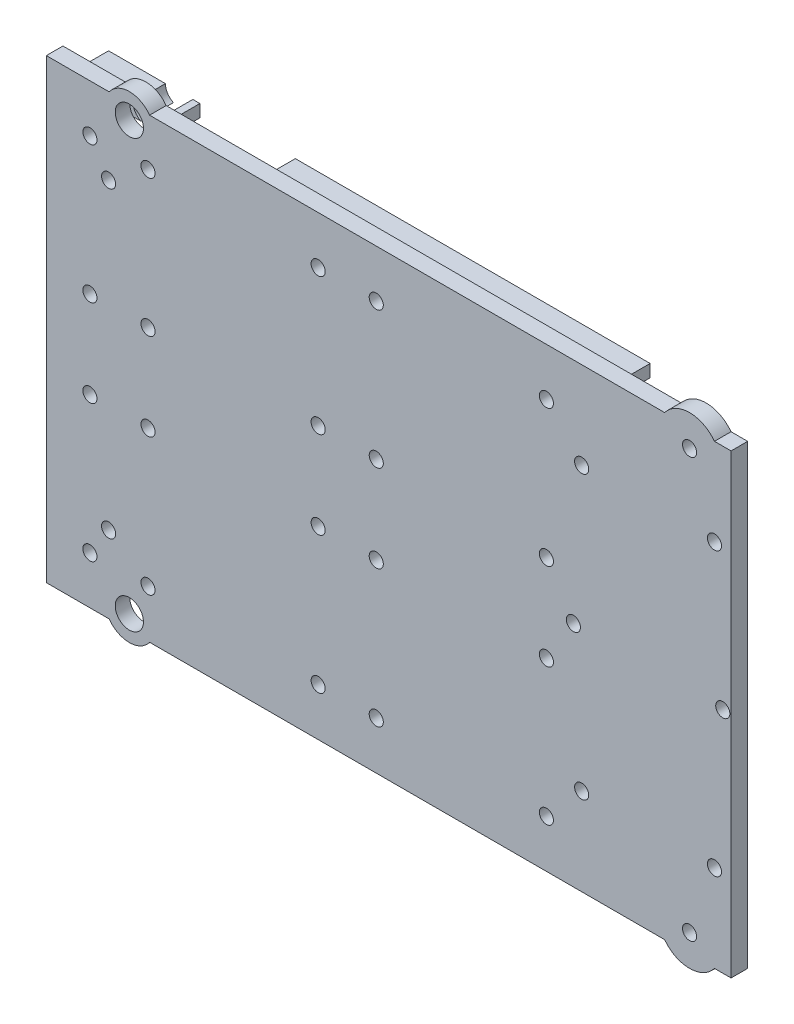
from build123d import *
from build123d.topology import SkipClean

# Parameters (mm, degrees)
MAIN_PROFILE_SKETCH_R       = 3.4
MAIN_PROFILE_SKETCH_R_2     = 1.7
MAIN_EXTRUSION_DEPTH        = 3.5
DETAIL_PROFILE_2_SKETCH_R   = 5.3
DETAIL_PROFILE_2_SKETCH_R_2 = 1.7
DETAIL_EXTRUSION_2_DEPTH    = 0.5
DETAIL_PROFILE_3_SKETCH_W   = 85.5
DETAIL_PROFILE_3_SKETCH_H   = 3
DETAIL_EXTRUSION_3_DEPTH    = 0.2
DETAIL_PROFILE_4_SKETCH_W   = 85.5
DETAIL_PROFILE_4_SKETCH_H   = 3
DETAIL_EXTRUSION_4_DEPTH    = 7.8


with BuildPart() as part:
    # Main Profile Sketch → Main Extrusion (new body)
    with BuildSketch(Plane.XY.offset(48.5)):
        with BuildLine():
            Line((55, -55), (70.126602828, -55))
            ThreePointArc((70.126602828, -55), (75, -57.5), (79.873397172, -55))
            Line((79.873397172, -55), (204, -55))
            ThreePointArc((204, -55), (210, -58), (216, -55))
            Line((216, -55), (220, -55))
            Line((220, -55), (220, 55))
            Line((220, 55), (216, 55))
            ThreePointArc((216, 55), (210, 58), (204, 55))
            Line((204, 55), (79.873397172, 55))
            ThreePointArc((79.873397172, 55), (75, 57.5), (70.126602828, 55))
            Line((70.126602828, 55), (55, 55))
            Line((55, 55), (55, -55))
        make_face()
        with Locations((75, -51.5)):
            Circle(MAIN_PROFILE_SKETCH_R, mode=Mode.SUBTRACT)
        with Locations((65.5, -43.5)):
            Circle(MAIN_PROFILE_SKETCH_R_2, mode=Mode.SUBTRACT)
        with Locations((70, -36.5)):
            Circle(MAIN_PROFILE_SKETCH_R_2, mode=Mode.SUBTRACT)
        with Locations((79.5, -43.5)):
            Circle(MAIN_PROFILE_SKETCH_R_2, mode=Mode.SUBTRACT)
        with Locations((120.5, -43.5)):
            Circle(MAIN_PROFILE_SKETCH_R_2, mode=Mode.SUBTRACT)
        with Locations((134.5, -43.5)):
            Circle(MAIN_PROFILE_SKETCH_R_2, mode=Mode.SUBTRACT)
        with Locations((65.5, -10.5)):
            Circle(MAIN_PROFILE_SKETCH_R_2, mode=Mode.SUBTRACT)
        with Locations((79.5, -10.5)):
            Circle(MAIN_PROFILE_SKETCH_R_2, mode=Mode.SUBTRACT)
        with Locations((120.5, -10.5)):
            Circle(MAIN_PROFILE_SKETCH_R_2, mode=Mode.SUBTRACT)
        with Locations((134.5, -10.5)):
            Circle(MAIN_PROFILE_SKETCH_R_2, mode=Mode.SUBTRACT)
        with Locations((175.5, -43.5)):
            Circle(MAIN_PROFILE_SKETCH_R_2, mode=Mode.SUBTRACT)
        with Locations((210, -50.5)):
            Circle(MAIN_PROFILE_SKETCH_R_2, mode=Mode.SUBTRACT)
        with Locations((184, -34)):
            Circle(MAIN_PROFILE_SKETCH_R_2, mode=Mode.SUBTRACT)
        with Locations((216, -34)):
            Circle(MAIN_PROFILE_SKETCH_R_2, mode=Mode.SUBTRACT)
        with Locations((175.5, -10.5)):
            Circle(MAIN_PROFILE_SKETCH_R_2, mode=Mode.SUBTRACT)
        with Locations((65.5, 10.5)):
            Circle(MAIN_PROFILE_SKETCH_R_2, mode=Mode.SUBTRACT)
        with Locations((79.5, 10.5)):
            Circle(MAIN_PROFILE_SKETCH_R_2, mode=Mode.SUBTRACT)
        with Locations((120.5, 10.5)):
            Circle(MAIN_PROFILE_SKETCH_R_2, mode=Mode.SUBTRACT)
        with Locations((134.5, 10.5)):
            Circle(MAIN_PROFILE_SKETCH_R_2, mode=Mode.SUBTRACT)
        with Locations((70, 36.5)):
            Circle(MAIN_PROFILE_SKETCH_R_2, mode=Mode.SUBTRACT)
        with Locations((65.5, 43.5)):
            Circle(MAIN_PROFILE_SKETCH_R_2, mode=Mode.SUBTRACT)
        with Locations((75, 51.5)):
            Circle(MAIN_PROFILE_SKETCH_R, mode=Mode.SUBTRACT)
        with Locations((79.5, 43.5)):
            Circle(MAIN_PROFILE_SKETCH_R_2, mode=Mode.SUBTRACT)
        with Locations((120.5, 43.5)):
            Circle(MAIN_PROFILE_SKETCH_R_2, mode=Mode.SUBTRACT)
        with Locations((134.5, 43.5)):
            Circle(MAIN_PROFILE_SKETCH_R_2, mode=Mode.SUBTRACT)
        with Locations((175.5, 10.5)):
            Circle(MAIN_PROFILE_SKETCH_R_2, mode=Mode.SUBTRACT)
        with Locations((182, 0)):
            Circle(MAIN_PROFILE_SKETCH_R_2, mode=Mode.SUBTRACT)
        with Locations((218, 0)):
            Circle(MAIN_PROFILE_SKETCH_R_2, mode=Mode.SUBTRACT)
        with Locations((175.5, 43.5)):
            Circle(MAIN_PROFILE_SKETCH_R_2, mode=Mode.SUBTRACT)
        with Locations((184, 34)):
            Circle(MAIN_PROFILE_SKETCH_R_2, mode=Mode.SUBTRACT)
        with Locations((216, 34)):
            Circle(MAIN_PROFILE_SKETCH_R_2, mode=Mode.SUBTRACT)
        with Locations((210, 50.5)):
            Circle(MAIN_PROFILE_SKETCH_R_2, mode=Mode.SUBTRACT)
    extrude(amount=-MAIN_EXTRUSION_DEPTH)

    # Detail Profile 2 Sketch → Detail Extrusion 2 (add)
    with BuildSketch(Plane.XY.offset(45)):
        with BuildLine():
            Line((55, -55), (70.126602828, -55))
            ThreePointArc((70.126602828, -55), (75, -57.5), (79.873397172, -55))
            Line((79.873397172, -55), (204, -55))
            ThreePointArc((204, -55), (210, -58), (216, -55))
            Line((216, -55), (220, -55))
            Line((220, -55), (220, 55))
            Line((220, 55), (216, 55))
            ThreePointArc((216, 55), (210, 58), (204, 55))
            Line((204, 55), (79.873397172, 55))
            ThreePointArc((79.873397172, 55), (75, 57.5), (70.126602828, 55))
            Line((70.126602828, 55), (55, 55))
            Line((55, 55), (55, -55))
        make_face()
        with Locations((75, -51.5)):
            Circle(DETAIL_PROFILE_2_SKETCH_R, mode=Mode.SUBTRACT)
        with Locations((65.5, -43.5)):
            Circle(DETAIL_PROFILE_2_SKETCH_R_2, mode=Mode.SUBTRACT)
        with Locations((70, -36.5)):
            Circle(DETAIL_PROFILE_2_SKETCH_R_2, mode=Mode.SUBTRACT)
        with Locations((79.5, -43.5)):
            Circle(DETAIL_PROFILE_2_SKETCH_R_2, mode=Mode.SUBTRACT)
        with Locations((120.5, -43.5)):
            Circle(DETAIL_PROFILE_2_SKETCH_R_2, mode=Mode.SUBTRACT)
        with Locations((134.5, -43.5)):
            Circle(DETAIL_PROFILE_2_SKETCH_R_2, mode=Mode.SUBTRACT)
        with Locations((65.5, -10.5)):
            Circle(DETAIL_PROFILE_2_SKETCH_R_2, mode=Mode.SUBTRACT)
        with Locations((79.5, -10.5)):
            Circle(DETAIL_PROFILE_2_SKETCH_R_2, mode=Mode.SUBTRACT)
        with Locations((120.5, -10.5)):
            Circle(DETAIL_PROFILE_2_SKETCH_R_2, mode=Mode.SUBTRACT)
        with Locations((134.5, -10.5)):
            Circle(DETAIL_PROFILE_2_SKETCH_R_2, mode=Mode.SUBTRACT)
        with Locations((175.5, -43.5)):
            Circle(DETAIL_PROFILE_2_SKETCH_R_2, mode=Mode.SUBTRACT)
        with Locations((210, -50.5)):
            Circle(DETAIL_PROFILE_2_SKETCH_R_2, mode=Mode.SUBTRACT)
        with Locations((184, -34)):
            Circle(DETAIL_PROFILE_2_SKETCH_R_2, mode=Mode.SUBTRACT)
        with Locations((216, -34)):
            Circle(DETAIL_PROFILE_2_SKETCH_R_2, mode=Mode.SUBTRACT)
        with Locations((175.5, -10.5)):
            Circle(DETAIL_PROFILE_2_SKETCH_R_2, mode=Mode.SUBTRACT)
        with Locations((65.5, 10.5)):
            Circle(DETAIL_PROFILE_2_SKETCH_R_2, mode=Mode.SUBTRACT)
        with Locations((79.5, 10.5)):
            Circle(DETAIL_PROFILE_2_SKETCH_R_2, mode=Mode.SUBTRACT)
        with Locations((120.5, 10.5)):
            Circle(DETAIL_PROFILE_2_SKETCH_R_2, mode=Mode.SUBTRACT)
        with Locations((134.5, 10.5)):
            Circle(DETAIL_PROFILE_2_SKETCH_R_2, mode=Mode.SUBTRACT)
        with Locations((70, 36.5)):
            Circle(DETAIL_PROFILE_2_SKETCH_R_2, mode=Mode.SUBTRACT)
        with Locations((65.5, 43.5)):
            Circle(DETAIL_PROFILE_2_SKETCH_R_2, mode=Mode.SUBTRACT)
        with Locations((75, 51.5)):
            Circle(DETAIL_PROFILE_2_SKETCH_R, mode=Mode.SUBTRACT)
        with Locations((79.5, 43.5)):
            Circle(DETAIL_PROFILE_2_SKETCH_R_2, mode=Mode.SUBTRACT)
        with Locations((120.5, 43.5)):
            Circle(DETAIL_PROFILE_2_SKETCH_R_2, mode=Mode.SUBTRACT)
        with Locations((134.5, 43.5)):
            Circle(DETAIL_PROFILE_2_SKETCH_R_2, mode=Mode.SUBTRACT)
        with Locations((175.5, 10.5)):
            Circle(DETAIL_PROFILE_2_SKETCH_R_2, mode=Mode.SUBTRACT)
        with Locations((182, 0)):
            Circle(DETAIL_PROFILE_2_SKETCH_R_2, mode=Mode.SUBTRACT)
        with Locations((218, 0)):
            Circle(DETAIL_PROFILE_2_SKETCH_R_2, mode=Mode.SUBTRACT)
        with Locations((175.5, 43.5)):
            Circle(DETAIL_PROFILE_2_SKETCH_R_2, mode=Mode.SUBTRACT)
        with Locations((184, 34)):
            Circle(DETAIL_PROFILE_2_SKETCH_R_2, mode=Mode.SUBTRACT)
        with Locations((216, 34)):
            Circle(DETAIL_PROFILE_2_SKETCH_R_2, mode=Mode.SUBTRACT)
        with Locations((210, 50.5)):
            Circle(DETAIL_PROFILE_2_SKETCH_R_2, mode=Mode.SUBTRACT)
    extrude(amount=-DETAIL_EXTRUSION_2_DEPTH)

    # Detail Profile 3 Sketch → Detail Extrusion 3 (add)
    with SkipClean():  # the faces are left unmerged after this step: merging them gives an invalid solid
        with BuildSketch(Plane.XY.offset(44.5)):
            with BuildLine():
                Line((58, -48.5), (70.630789545, -48.5))
                ThreePointArc((70.630789545, -48.5), (69.938043095, -49.929461145), (69.7, -51.5))
                Line((69.7, -51.5), (58, -51.5))
                Line((58, -51.5), (58, -48.5))
            make_face()
            with BuildLine():
                Line((79.369210455, -48.5), (80, -48.5))
                Line((80, -48.5), (80, -49.742160417))
                ThreePointArc((80, -49.742160417), (79.725596974, -49.100263923), (79.369210455, -48.5))
            make_face()
            with Locations((145.75, -50)):
                Rectangle(DETAIL_PROFILE_3_SKETCH_W, DETAIL_PROFILE_3_SKETCH_H)
            with BuildLine():
                Line((58, 51.5), (58, 48.5))
                Line((58, 48.5), (70.630789545, 48.5))
                ThreePointArc((70.630789545, 48.5), (69.938043095, 49.929461145), (69.7, 51.5))
                Line((69.7, 51.5), (58, 51.5))
            make_face()
            with BuildLine():
                Line((80, 49.742160417), (80, 48.5))
                Line((80, 48.5), (79.369210455, 48.5))
                ThreePointArc((79.369210455, 48.5), (79.725596974, 49.100263923), (80, 49.742160417))
            make_face()
            with Locations((145.75, 50)):
                Rectangle(DETAIL_PROFILE_3_SKETCH_W, DETAIL_PROFILE_3_SKETCH_H)
        extrude(amount=-DETAIL_EXTRUSION_3_DEPTH)

    # Detail Profile 4 Sketch → Detail Extrusion 4 (add)
    with SkipClean():  # the faces are left unmerged after this step: merging them gives an invalid solid
        with BuildSketch(Plane.XY.offset(44.3)):
            with BuildLine():
                Line((58, -48.5), (73.625227292, -48.5))
                ThreePointArc((73.625227292, -48.5), (72.222703658, -49.717691096), (71.7, -51.5))
                Line((71.7, -51.5), (58, -51.5))
                Line((58, -51.5), (58, -48.5))
            make_face()
            with BuildLine():
                Line((80, -48.5), (80, -51.5))
                Line((80, -51.5), (78.3, -51.5))
                ThreePointArc((78.3, -51.5), (77.777296342, -49.717691096), (76.374772708, -48.5))
                Line((76.374772708, -48.5), (80, -48.5))
            make_face()
            with Locations((145.75, -50)):
                Rectangle(DETAIL_PROFILE_4_SKETCH_W, DETAIL_PROFILE_4_SKETCH_H)
            with BuildLine():
                Line((58, 51.5), (58, 48.5))
                Line((58, 48.5), (73.625227292, 48.5))
                ThreePointArc((73.625227292, 48.5), (72.222703658, 49.717691096), (71.7, 51.5))
                Line((71.7, 51.5), (58, 51.5))
            make_face()
            with BuildLine():
                Line((78.3, 51.5), (80, 51.5))
                Line((80, 51.5), (80, 48.5))
                Line((80, 48.5), (76.374772708, 48.5))
                ThreePointArc((76.374772708, 48.5), (77.777296342, 49.717691096), (78.3, 51.5))
            make_face()
            with Locations((145.75, 50)):
                Rectangle(DETAIL_PROFILE_4_SKETCH_W, DETAIL_PROFILE_4_SKETCH_H)
        extrude(amount=-DETAIL_EXTRUSION_4_DEPTH)


solid = part.part
